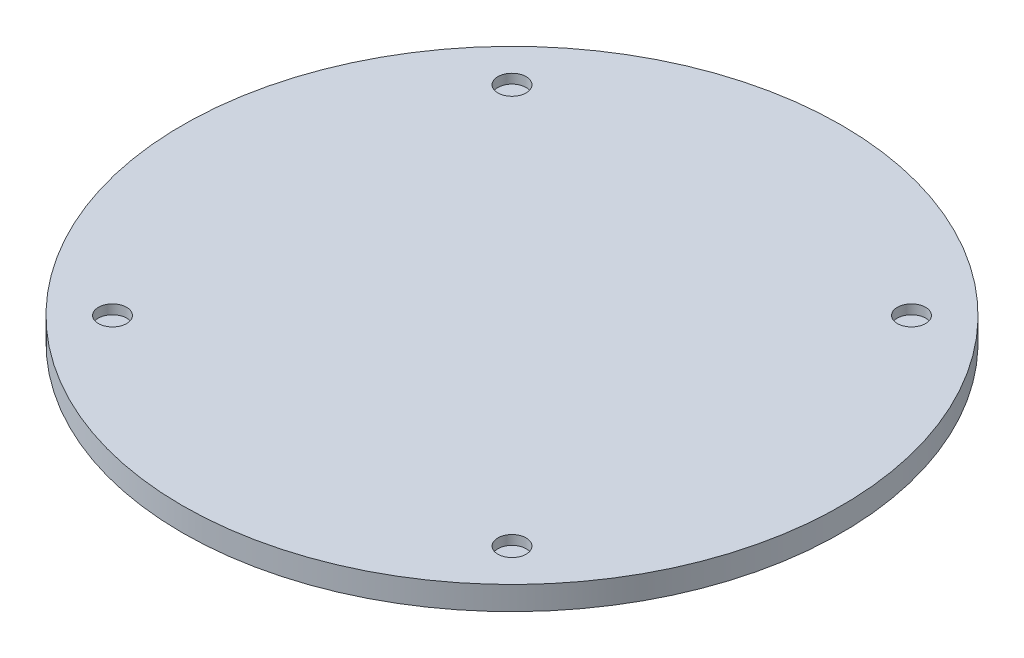
from build123d import *

# Parameters (mm, degrees)
SKETCH_1_R          = 70
EXTRUDE_1_DEPTH     = 5
SKETCH_2_R          = 3
CUT_EXTRUDE_1_DEPTH = 2


with BuildPart() as part:
    # 草图1 → 凸台-拉伸1 (new body)
    with BuildSketch(Plane(origin=(0, 0, 0), x_dir=(1, 0, 0), z_dir=(0, 1, 0))):
        with Locations(Location((0, 0, 0), (0, 0, 270))):
            Circle(SKETCH_1_R)
    extrude(amount=EXTRUDE_1_DEPTH)

    # 草图2 → 切除-拉伸1 (cut)
    with BuildSketch(Plane(origin=(0, 5, 0), x_dir=(1, 0, 0), z_dir=(0, 1, 0))):
        with Locations(Location((-42.426406871, 42.426406871, 0), (0, 0, 270))):
            Circle(SKETCH_2_R)
        with Locations(Location((42.426406871, 42.426406871, 0), (0, 0, 270))):
            Circle(SKETCH_2_R)
        with Locations(Location((-42.426406871, -42.426406871, 0), (0, 0, 270))):
            Circle(SKETCH_2_R)
        with Locations(Location((42.426406871, -42.426406871, 0), (0, 0, 270))):
            Circle(SKETCH_2_R)
    extrude(amount=-CUT_EXTRUDE_1_DEPTH, mode=Mode.SUBTRACT)


solid = part.part
